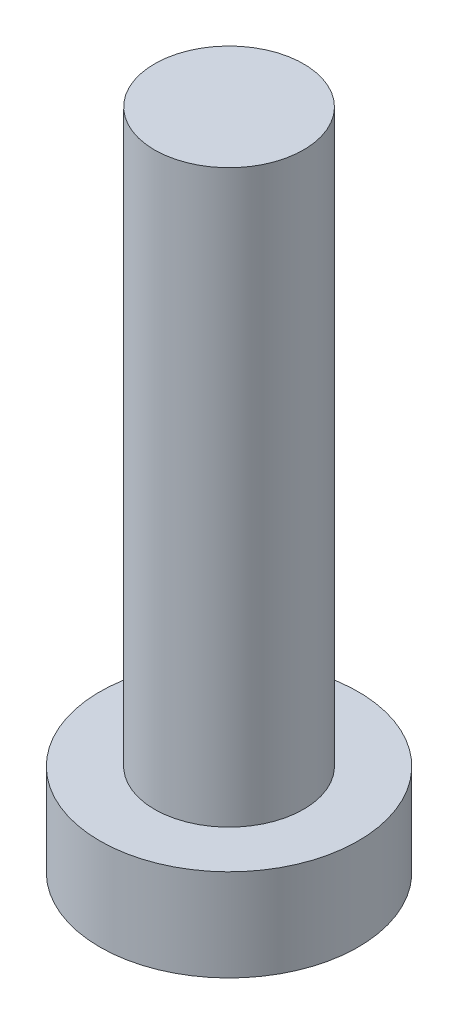
from build123d import *

# Parameters (mm, degrees)
SKETCH2_R           = 2.6
BOSS_EXTRUDE1_DEPTH = 1.85
SKETCH3_R           = 1.5
BOSS_EXTRUDE2_DEPTH = 11.49


with BuildPart() as part:
    # Sketch2 → Boss-Extrude1 (new body)
    with BuildSketch(Plane(origin=(0, 0, 0), x_dir=(1, 0, 0), z_dir=(0, 1, 0))):
        with Locations(Location((0, 0, 0), (0, 0, 270))):
            Circle(SKETCH2_R)
    extrude(amount=BOSS_EXTRUDE1_DEPTH)

    # Sketch3 → Boss-Extrude2 (add)
    with BuildSketch(Plane(origin=(0, 1.85, 0), x_dir=(1, 0, 0), z_dir=(0, 1, 0))):
        with Locations(Location((0, 0, 0), (0, 0, 270))):
            Circle(SKETCH3_R)
    extrude(amount=BOSS_EXTRUDE2_DEPTH)


solid = part.part
